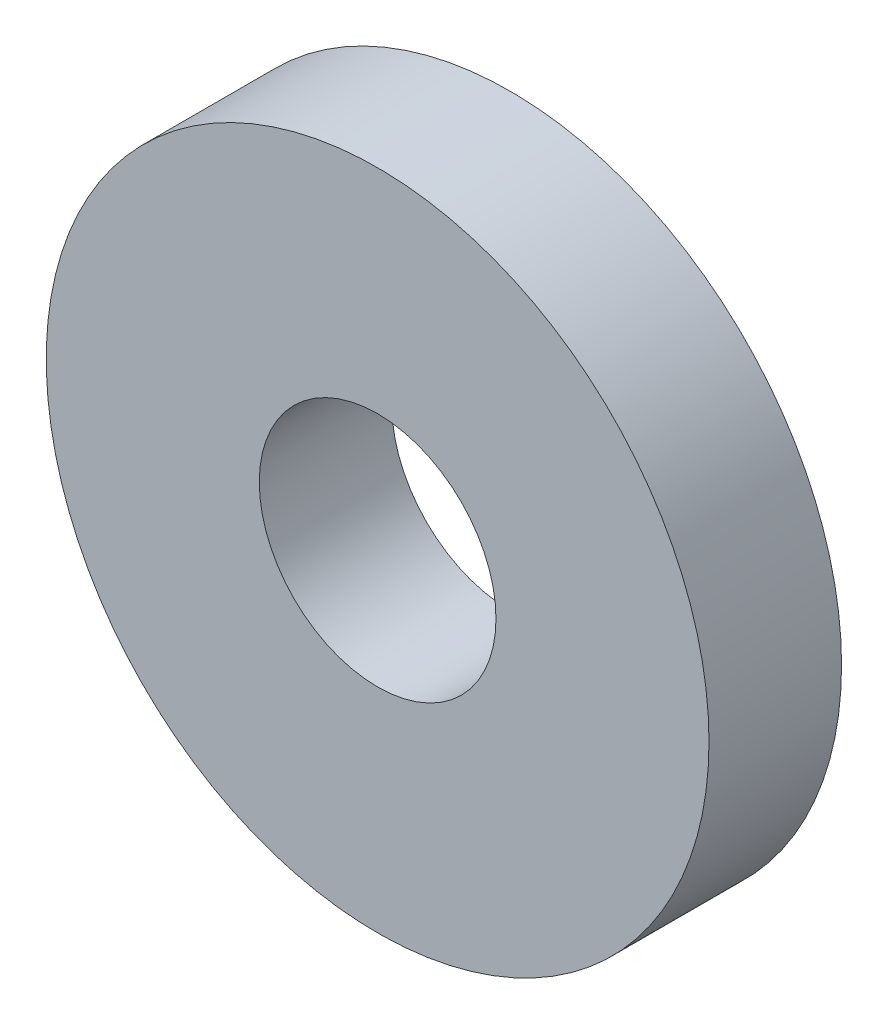
from build123d import *

# Parameters (mm, degrees)
SKETCH_1_R          = 7
EXTRUDE_1_DEPTH     = 2.8
SKETCH_2_R          = 2.5
CUT_EXTRUDE_1_DEPTH = 2.8


with BuildPart() as part:
    # 草圖1 → 填料-伸長1 (new body)
    with BuildSketch(Plane.XY):
        Circle(SKETCH_1_R)
    extrude(amount=EXTRUDE_1_DEPTH)

    # 草圖2 → 除料-伸長1 (cut)
    with BuildSketch(Plane.XY.offset(2.8)):
        Circle(SKETCH_2_R)
    extrude(amount=-CUT_EXTRUDE_1_DEPTH, mode=Mode.SUBTRACT)


solid = part.part
